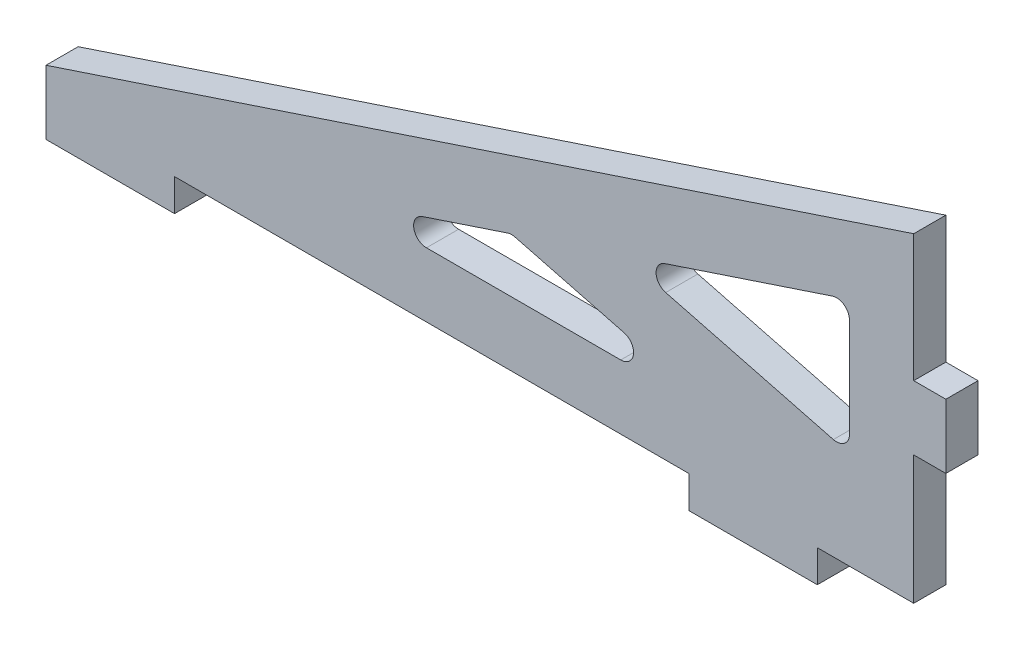
from build123d import *

# Parameters (mm, degrees)
BOSS_EXTRUDE1_DEPTH = 6.35
CUT_EXTRUDE1_DEPTH  = 226.36350526
FILLET1_R           = 2.54


with BuildPart() as part:
    # Sketch2 → Boss-Extrude1 (new body)
    with BuildSketch(Plane.XY):
        Polygon((-92.950015109, 148.30800019), (78.499984891, 205.20400019), (78.499984891, 180.05800019), (84.849984891, 180.05800019), (84.849984891, 167.35800019), (78.499984891, 167.35800019), (78.499984891, 141.95800019), (59.449984891, 141.95800019), (59.449984891, 135.60800019), (34.049984891, 135.60800019), (34.049984891, 141.95800019), (-67.550015109, 141.95800019), (-67.550015109, 135.60800019), (-92.950015109, 135.60800019), (-92.950015109, 141.95800019), align=None)
    extrude(amount=BOSS_EXTRUDE1_DEPTH)

    # Sketch3 → Cut-Extrude1 (cut, through all)
    with BuildSketch(Plane.XY.offset(6.35)):
        Polygon((-1.019446214, 165.434292154), (-33.492647443, 154.65800019), (40.515121465, 154.65800019), align=None)
        Polygon((65.799984891, 187.608444106), (21.169587996, 172.797764247), (65.799984891, 161.218248334), align=None)
    extrude(amount=-CUT_EXTRUDE1_DEPTH, mode=Mode.SUBTRACT)

    # Fillet1
    fillet1_edges = [part.edges().sort_by_distance(p)[0] for p in [
        (65.799984891, 161.218248334, 3.175),
        (21.169587996, 172.797764247, 3.175),
        (65.799984891, 187.608444106, 3.175),
        (40.515121465, 154.65800019, 3.175),
        (-33.492647443, 154.65800019, 3.175),
        (-1.019446214, 165.434292154, 3.175),
    ]]
    fillet(fillet1_edges, radius=FILLET1_R)


solid = part.part
